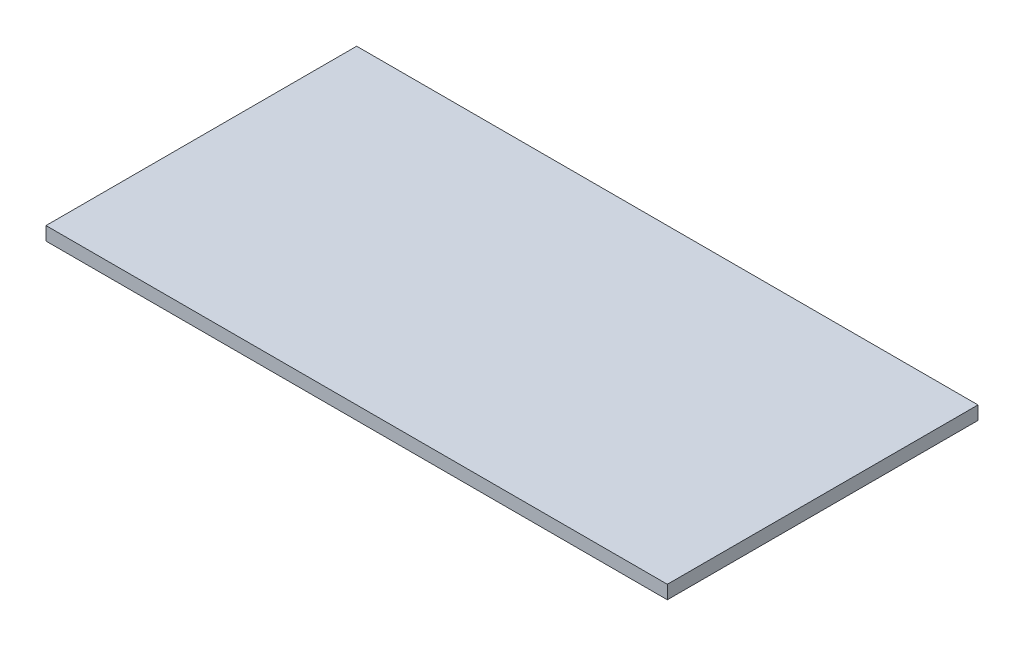
from build123d import *

# Parameters (mm, degrees)
SKETCH1_W           = 152.4
SKETCH1_H           = 76.2
BOSS_EXTRUDE1_DEPTH = 3.302


with BuildPart() as part:
    # Sketch1 → Boss-Extrude1 (new body)
    with BuildSketch(Plane(origin=(0, 0, 0), x_dir=(1, 0, 0), z_dir=(0, 1, 0))):
        Rectangle(SKETCH1_W, SKETCH1_H)
    extrude(amount=BOSS_EXTRUDE1_DEPTH)


solid = part.part
